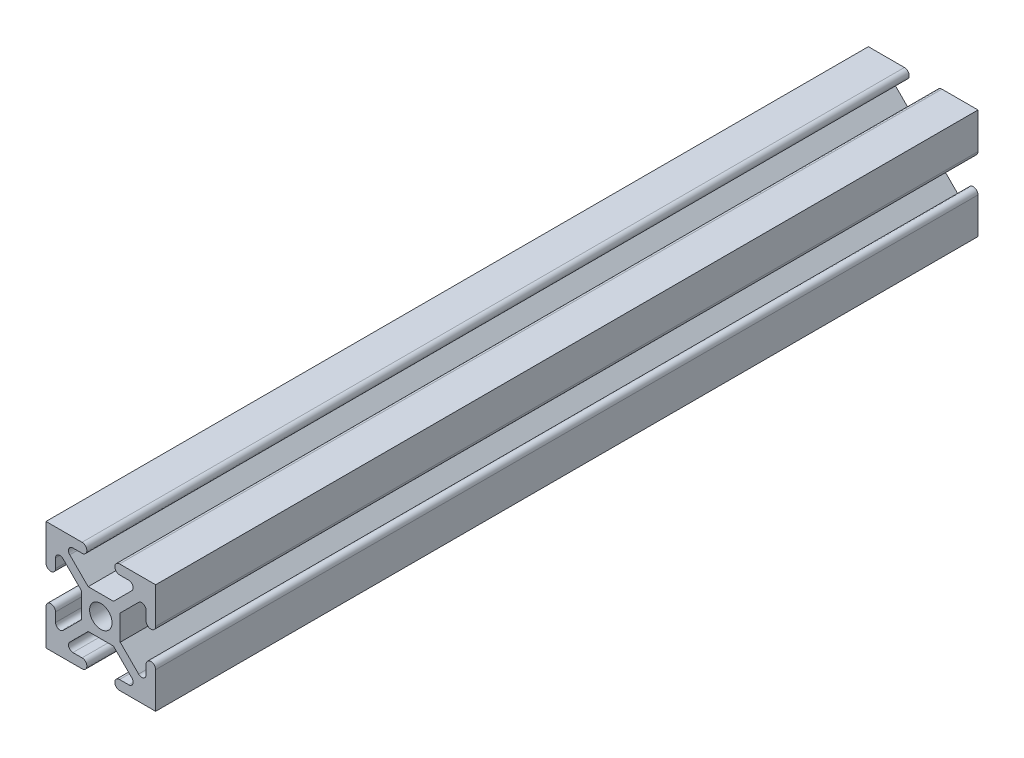
from build123d import *

# Parameters (mm, degrees)
SKETCH1_R           = 2.6035
BOSS_EXTRUDE1_DEPTH = 190.5


with BuildPart() as part:
    # Sketch1 → Boss-Extrude1 (new body)
    with BuildSketch(Plane.XY):
        with BuildLine():
            Line((-12.7, -12.7), (-4.343399971, -12.7))
            ThreePointArc((-4.343399971, -12.7), (-3.238499971, -11.5951), (-4.343399971, -10.4902))
            Line((-4.343399971, -10.4902), (-6.474794456, -10.4902))
            ThreePointArc((-6.474794456, -10.4902), (-7.413456061, -9.863006367), (-7.193214945, -8.75577951))
            Line((-7.193214945, -8.75577951), (-2.933235435, -4.4958))
            Line((-2.933235435, -4.4958), (2.933235435, -4.4958))
            Line((2.933235435, -4.4958), (7.193214945, -8.75577951))
            ThreePointArc((7.193214945, -8.75577951), (7.413456061, -9.863006367), (6.474794456, -10.4902))
            Line((6.474794456, -10.4902), (4.3434, -10.4902))
            ThreePointArc((4.3434, -10.4902), (3.2385, -11.5951), (4.3434, -12.7))
            Line((4.3434, -12.7), (12.7, -12.7))
            Line((12.7, -12.7), (12.7, -4.343399971))
            ThreePointArc((12.7, -4.343399971), (11.5951, -3.238499971), (10.4902, -4.343399971))
            Line((10.4902, -4.343399971), (10.4902, -6.474794456))
            ThreePointArc((10.4902, -6.474794456), (9.863006367, -7.413456061), (8.75577951, -7.193214945))
            Line((8.75577951, -7.193214945), (4.4958, -2.933235435))
            Line((4.4958, -2.933235435), (4.4958, 2.933235435))
            Line((4.4958, 2.933235435), (8.75577951, 7.193214945))
            ThreePointArc((8.75577951, 7.193214945), (9.863006367, 7.413456061), (10.4902, 6.474794456))
            Line((10.4902, 6.474794456), (10.4902, 4.3434))
            ThreePointArc((10.4902, 4.3434), (11.5951, 3.2385), (12.7, 4.3434))
            Line((12.7, 4.3434), (12.7, 12.7))
            Line((12.7, 12.7), (4.343399971, 12.7))
            ThreePointArc((4.343399971, 12.7), (3.238499971, 11.5951), (4.343399971, 10.4902))
            Line((4.343399971, 10.4902), (6.474794456, 10.4902))
            ThreePointArc((6.474794456, 10.4902), (7.413456061, 9.863006367), (7.193214945, 8.75577951))
            Line((7.193214945, 8.75577951), (2.933235435, 4.4958))
            Line((2.933235435, 4.4958), (-2.933235435, 4.4958))
            Line((-2.933235435, 4.4958), (-7.193214945, 8.75577951))
            ThreePointArc((-7.193214945, 8.75577951), (-7.413456061, 9.863006367), (-6.474794456, 10.4902))
            Line((-6.474794456, 10.4902), (-4.3434, 10.4902))
            ThreePointArc((-4.3434, 10.4902), (-3.2385, 11.5951), (-4.3434, 12.7))
            Line((-4.3434, 12.7), (-12.7, 12.7))
            Line((-12.7, 12.7), (-12.7, 4.343399971))
            ThreePointArc((-12.7, 4.343399971), (-11.5951, 3.238499971), (-10.4902, 4.343399971))
            Line((-10.4902, 4.343399971), (-10.4902, 6.474794456))
            ThreePointArc((-10.4902, 6.474794456), (-9.863006367, 7.413456061), (-8.75577951, 7.193214945))
            Line((-8.75577951, 7.193214945), (-4.4958, 2.933235435))
            Line((-4.4958, 2.933235435), (-4.4958, -2.933235435))
            Line((-4.4958, -2.933235435), (-8.75577951, -7.193214945))
            ThreePointArc((-8.75577951, -7.193214945), (-9.863006367, -7.413456061), (-10.4902, -6.474794456))
            Line((-10.4902, -6.474794456), (-10.4902, -4.3434))
            ThreePointArc((-10.4902, -4.3434), (-11.5951, -3.2385), (-12.7, -4.3434))
            Line((-12.7, -4.3434), (-12.7, -12.7))
        make_face()
        with Locations(Location((0, 0, 0), (0, 0, 180))):
            Circle(SKETCH1_R, mode=Mode.SUBTRACT)
    extrude(amount=-BOSS_EXTRUDE1_DEPTH)


solid = part.part
